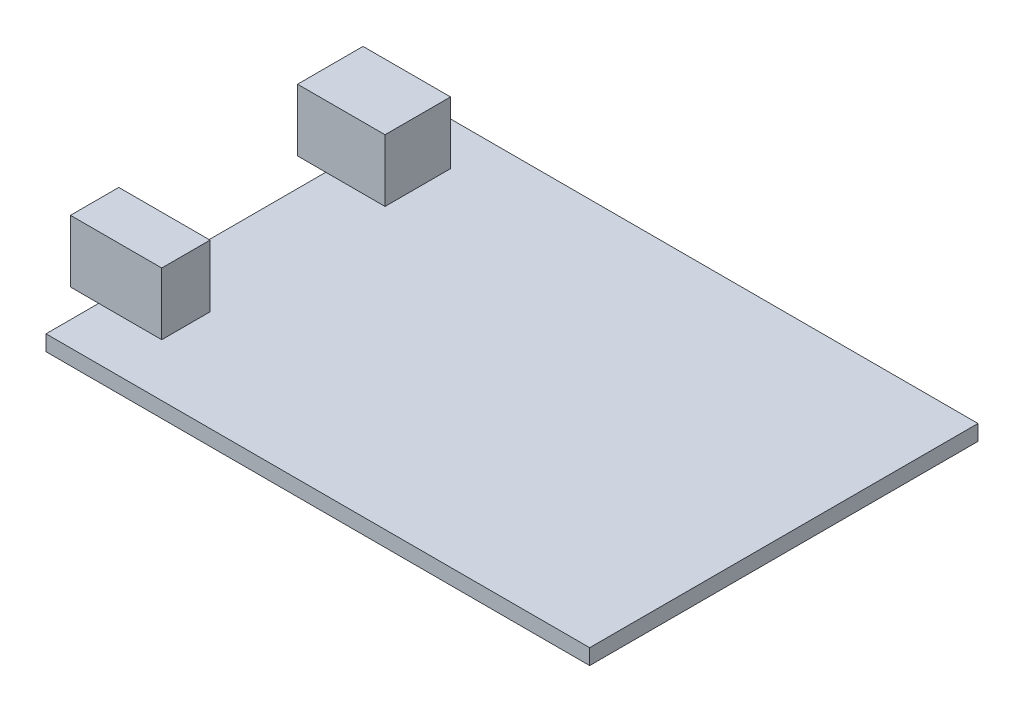
from build123d import *

# Parameters (mm, degrees)
SKETCH_1_W          = 70
SKETCH_1_H          = 50
EXTRUDE_1_DEPTH     = 2
SKETCH_2_W          = 11.266192233
SKETCH_2_H          = 8.432364739
SKETCH_2_W_2        = 11.75001644
SKETCH_2_H_2        = 6.220596939
EXTRUDE_2_DEPTH     = 8
SKETCH_3_R          = 2.073259277
SKETCH_3_W          = 5.968463231
SKETCH_3_H          = 1.961690003
SKETCH_3_H_2        = 1.772031982
CUT_EXTRUDE_1_DEPTH = 8


with BuildPart() as part:
    # 草图1 → 凸台-拉伸1 (new body)
    with BuildSketch(Plane(origin=(0, 0, 0), x_dir=(1, 0, 0), z_dir=(0, 1, 0))):
        with Locations((12.700831025, -15.40166205)):
            Rectangle(SKETCH_1_W, SKETCH_1_H)
    extrude(amount=EXTRUDE_1_DEPTH)

    # 草图2 → 凸台-拉伸2 (add)
    with BuildSketch(Plane(origin=(0, 2, 0), x_dir=(1, 0, 0), z_dir=(0, 1, 0))):
        with Locations((-20.302891623, -0.16119955)):
            Rectangle(SKETCH_2_W, SKETCH_2_H)
        with Locations((-20.060979519, -30.503889063)):
            Rectangle(SKETCH_2_W_2, SKETCH_2_H_2)
    extrude(amount=EXTRUDE_2_DEPTH)

    # 草图3 → 切除-拉伸1 (cut)
    with BuildSketch(Plane.ZY.offset(25.935987739)):
        with Locations((30.500300108, 5.554053281)):
            Circle(SKETCH_3_R)
        with Locations((0.41832149, 4.57320828)):
            Rectangle(SKETCH_3_W, SKETCH_3_H)
        with Locations((0.41832149, 7.612359017)):
            Rectangle(SKETCH_3_W, SKETCH_3_H_2)
    extrude(amount=-CUT_EXTRUDE_1_DEPTH, mode=Mode.SUBTRACT)


solid = part.part
